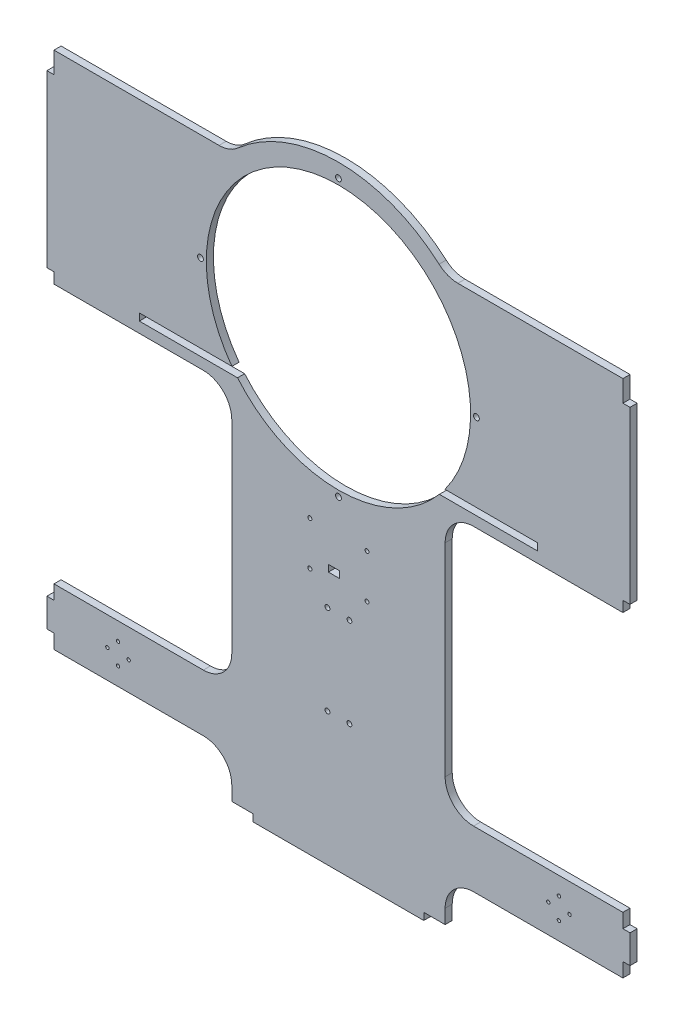
from build123d import *

# Parameters (mm, degrees)
MAIN_BODY_SKETCH_R     = 117.99951
MAIN_BODY_DEPTH        = 3.175
TABS_SKETCH_W          = 6.35
TABS_SKETCH_H          = 152.4
TABS_SKETCH_W_2        = 152.4
TABS_SKETCH_H_2        = 6.35
OUTSIDE_TABS_DEPTH     = 6.35
F_6_0_204_TUBE_MOUNT_D = 5.1816
SKETCH12_W             = 165.1
SKETCH12_H             = 50.8
BOSS_EXTRUDE1_DEPTH    = 6.35
SKETCH13_R             = 1.5
CUT_EXTRUDE1_DEPTH     = 489.042014073
SKETCH14_W             = 6.35
SKETCH14_H             = 12.7
CUT_EXTRUDE2_DEPTH     = 489.042014073
SKETCH15_W             = 87.70313901
SKETCH15_H             = 6.35
CUT_EXTRUDE3_DEPTH     = 489.042014073
SKETCH16_R             = 1.8
SKETCH16_R_2           = 2.159
SKETCH16_W             = 10
SKETCH16_H             = 6
CUT_EXTRUDE4_DEPTH     = 489.042014073
SKETCH18_W             = 158.75
SKETCH18_H             = 10.820932089
CUT_EXTRUDE6_DEPTH     = 489.042014073
FILLET1_R              = 25.4


with BuildPart() as part:
    # Main Body Sketch → Main Body (new, symmetric)
    with BuildSketch(Plane.XY):
        with BuildLine():
            Line((-96.545932089, -95.25), (-254, -95.25))
            Line((-254, -95.25), (-254, 95.25))
            Line((-254, 95.25), (-96.545932089, 95.25))
            ThreePointArc((-96.545932089, 95.25), (0, 135.6233), (96.545932089, 95.25))
            Line((96.545932089, 95.25), (254, 95.25))
            Line((254, 95.25), (254, -95.25))
            Line((254, -95.25), (96.545932089, -95.25))
            ThreePointArc((96.545932089, -95.25), (95.900155117, -95.900155117), (95.25, -96.545932089))
            Line((95.25, -96.545932089), (95.25, -406.4))
            Line((95.25, -406.4), (-95.25, -406.4))
            Line((-95.25, -406.4), (-95.25, -96.545932089))
            ThreePointArc((-95.25, -96.545932089), (-95.900155117, -95.900155117), (-96.545932089, -95.25))
        make_face()
        Circle(MAIN_BODY_SKETCH_R, mode=Mode.SUBTRACT)
    extrude(amount=MAIN_BODY_DEPTH, both=True)

    # Tabs Sketch → Outside Tabs (add)
    with BuildSketch(Plane.XY.offset(3.175)):
        with Locations((-257.175, 0)):
            Rectangle(TABS_SKETCH_W, TABS_SKETCH_H)
        with Locations((0, -409.575)):
            Rectangle(TABS_SKETCH_W_2, TABS_SKETCH_H_2)
    outside_tabs = extrude(amount=-OUTSIDE_TABS_DEPTH)

    # Outside Tabs Mirror: Outside Tabs across plane
    add(outside_tabs.mirror(Plane(origin=(0, 0, 0), x_dir=(0, 0, 1), z_dir=(1, 0, 0))))

    # #6 (0.204) Tube Mount (through all)
    with Locations(Plane.XY.offset(3.175)):
        with Locations((0, -123.19), (123.19, 0), (0, 123.19), (-123.19, 0)):
            Hole(F_6_0_204_TUBE_MOUNT_D / 2)

    # Sketch12 → Boss-Extrude1 (add)
    with BuildSketch(Plane.XY.offset(3.175)):
        with Locations((-177.8, -342.9)):
            Rectangle(SKETCH12_W, SKETCH12_H)
        with Locations((177.8, -342.9)):
            Rectangle(SKETCH12_W, SKETCH12_H)
    extrude(amount=-BOSS_EXTRUDE1_DEPTH)

    # Sketch13 → Cut-Extrude1 (cut, through all)
    with BuildSketch(Plane.XY.offset(3.175)):
        with Locations((-196.85, -333.4)):
            Circle(SKETCH13_R)
        with Locations((-187.35, -342.9)):
            Circle(SKETCH13_R)
        with Locations((-196.85, -352.4)):
            Circle(SKETCH13_R)
        with Locations((-206.35, -342.9)):
            Circle(SKETCH13_R)
    cut_extrude1 = extrude(amount=-CUT_EXTRUDE1_DEPTH, mode=Mode.SUBTRACT)

    # Mirror2: Cut-Extrude1 across plane
    add(cut_extrude1.mirror(Plane(origin=(0, 0, 0), x_dir=(0, 0, 1), z_dir=(1, 0, 0))), mode=Mode.SUBTRACT)

    # Sketch14 → Cut-Extrude2 (cut, through all)
    with BuildSketch(Plane.XY.offset(3.175)):
        with Locations((-257.175, -323.85)):
            Rectangle(SKETCH14_W, SKETCH14_H)
        with Locations((-257.175, -361.95)):
            Rectangle(SKETCH14_W, SKETCH14_H)
    cut_extrude2 = extrude(amount=-CUT_EXTRUDE2_DEPTH, mode=Mode.SUBTRACT)

    # Mirror3: Cut-Extrude2 across plane
    add(cut_extrude2.mirror(Plane(origin=(0, 0, 0), x_dir=(0, 0, 1), z_dir=(1, 0, 0))), mode=Mode.SUBTRACT)

    # Sketch15 → Cut-Extrude3 (cut, through all)
    with BuildSketch(Plane.XY.offset(3.175)):
        with Locations((-133.948430495, -73.025)):
            Rectangle(SKETCH15_W, SKETCH15_H)
        with Locations((133.948430495, -73.025)):
            Rectangle(SKETCH15_W, SKETCH15_H)
    extrude(amount=-CUT_EXTRUDE3_DEPTH, mode=Mode.SUBTRACT)

    # Sketch16 → Cut-Extrude4 (cut, through all)
    with BuildSketch(Plane.XY.offset(3.175)):
        with Locations((-25.5, -152.39951)):
            Circle(SKETCH16_R)
        with Locations(Location((-25.5, -191.39951, 0), (0, 0, 180))):
            Circle(SKETCH16_R)
        with Locations((25.5, -191.39951)):
            Circle(SKETCH16_R)
        with Locations(Location((25.5, -152.39951, 0), (0, 0, 180))):
            Circle(SKETCH16_R)
        with Locations((-9.795, -213.74951)):
            Circle(SKETCH16_R_2)
        with Locations(Location((-9.795, -293.74951, 0), (0, 0, 180))):
            Circle(SKETCH16_R_2)
        with Locations(Location((9.795, -213.74951, 0), (0, 0, 180))):
            Circle(SKETCH16_R_2)
        with Locations((9.795, -293.74951)):
            Circle(SKETCH16_R_2)
        with Locations((-4, -182.89951)):
            Rectangle(SKETCH16_W, SKETCH16_H)
    extrude(amount=-CUT_EXTRUDE4_DEPTH, mode=Mode.SUBTRACT)

    # Sketch18 → Cut-Extrude6 (cut, through all)
    with BuildSketch(Plane.XY.offset(3.175)):
        with Locations((-174.625, -91.135466045)):
            Rectangle(SKETCH18_W, SKETCH18_H)
    cut_extrude6 = extrude(amount=-CUT_EXTRUDE6_DEPTH, mode=Mode.SUBTRACT)

    # Mirror4: Cut-Extrude6 across plane
    add(cut_extrude6.mirror(Plane(origin=(0, 0, 0), x_dir=(0, 0, 1), z_dir=(1, 0, 0))), mode=Mode.SUBTRACT)

    # Fillet1
    fillet1_edges = [part.edges().sort_by_distance(p)[0] for p in [
        (-95.25, -317.5, 0),
        (-95.25, -368.3, 0),
        (95.25, -317.5, 0),
        (95.25, -368.3, 0),
        (-96.545932089, 95.25, 0),
        (96.545932089, 95.25, 0),
        (-95.25, -85.725, 0),
        (95.25, -85.725, 0),
    ]]
    fillet(fillet1_edges, radius=FILLET1_R)


solid = part.part
